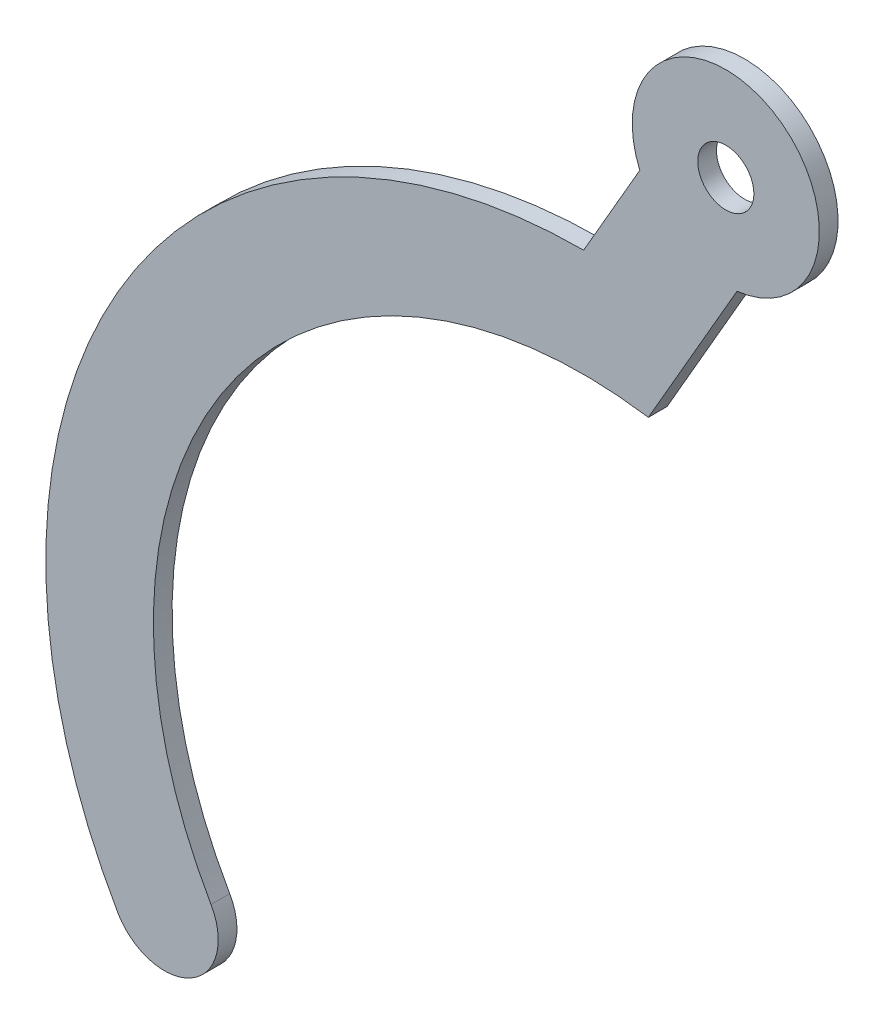
from build123d import *

# Parameters (mm, degrees)
SKETCH_1_R      = 3
EXTRUDE_1_DEPTH = 2


with BuildPart() as part:
    # 草图1 → 凸台-拉伸1 (new body)
    with BuildSketch(Plane.XY):
        with BuildLine():
            Line((0, 57.5), (6, 67.892304845))
            ThreePointArc((6, 67.892304845), (20.196152423, 80.480762114), (16.392304845, 61.892304845))
            Line((16.392304845, 61.892304845), (6.915077614, 45.477265766))
            ThreePointArc((6.915077614, 45.477265766), (-37.990130297, 25.937424699), (-39.837168574, -23))
            ThreePointArc((-39.837168574, -23), (-41.941814646, -30.854646072), (-49.796460718, -28.75))
            ThreePointArc((-49.796460718, -28.75), (-49.796460718, 28.75), (0, 57.5))
        make_face()
        with Locations((15.196152423, 71.820508076)):
            Circle(SKETCH_1_R, mode=Mode.SUBTRACT)
    extrude(amount=EXTRUDE_1_DEPTH)


solid = part.part
